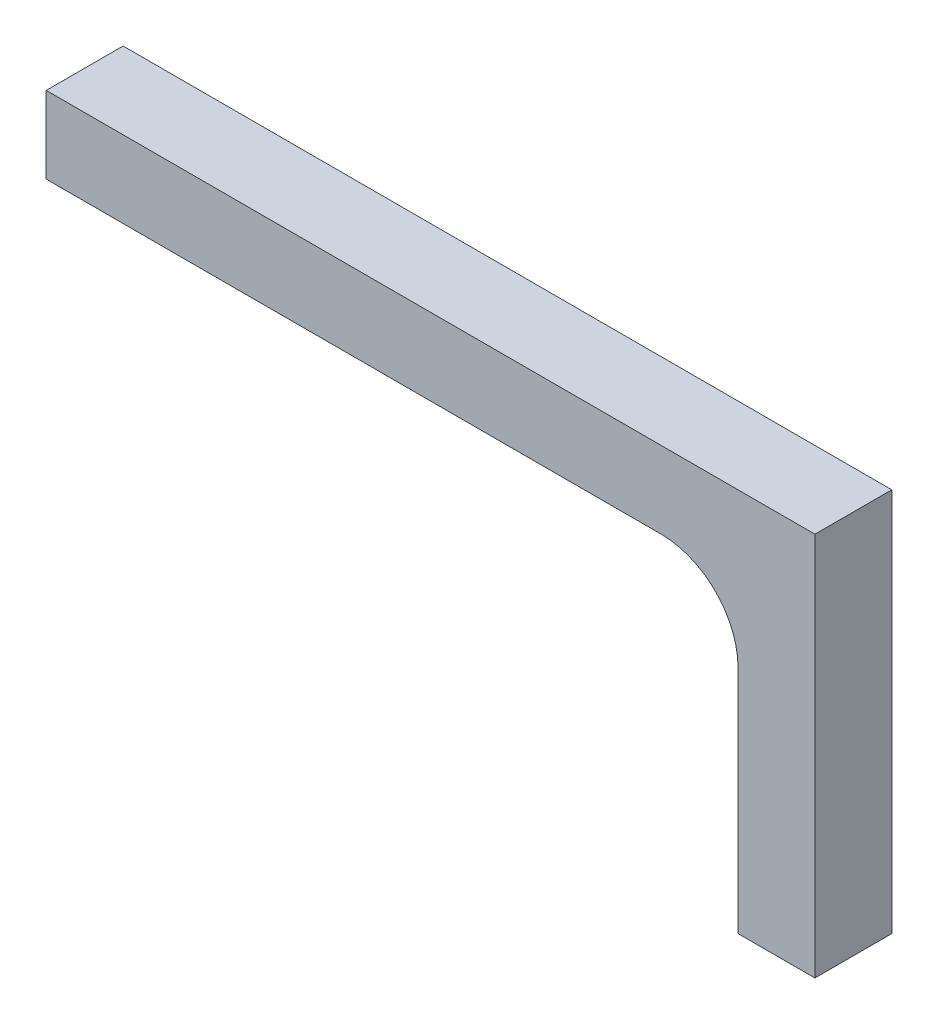
from build123d import *

# Parameters (mm, degrees)
BOSS_EXTRU_1_DEPTH = 10
CONG_1_R           = 10


with BuildPart() as part:
    # Esquisse1 → Boss.-Extru.1 (new body)
    with BuildSketch(Plane.XY):
        Polygon((0, 0), (0, 10), (100, 10), (100, -40), (90, -40), (90, 0), align=None)
    extrude(amount=BOSS_EXTRU_1_DEPTH)

    # Congé1
    cong_1_edges = [part.edges().sort_by_distance(p)[0] for p in [
        (90, 0, 5),
    ]]
    fillet(cong_1_edges, radius=CONG_1_R)


solid = part.part
